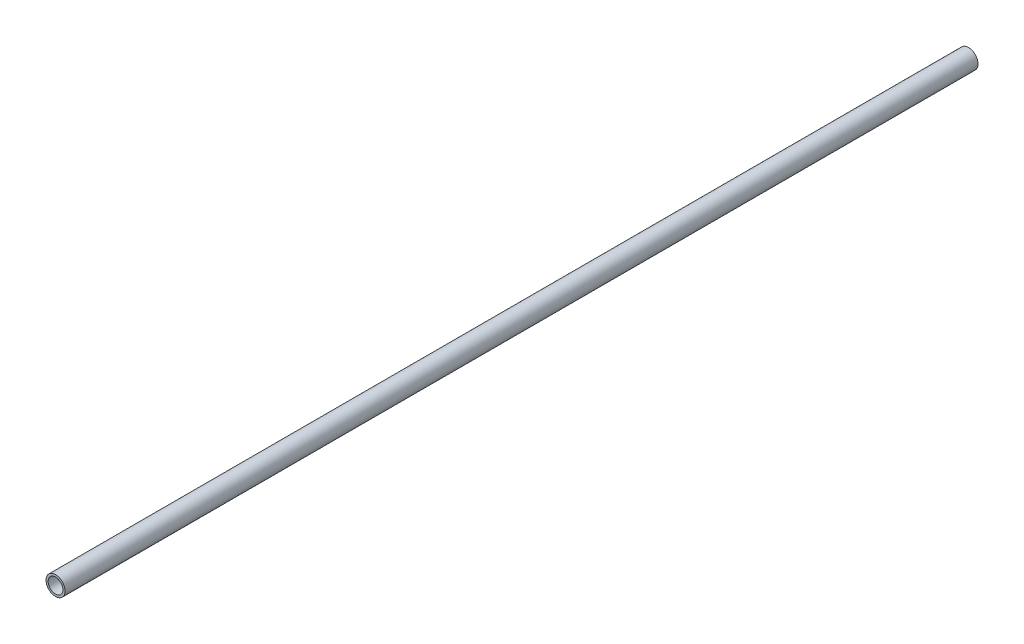
from build123d import *

# Parameters (mm, degrees)
SKETCH2_R           = 3.175
SKETCH2_R_2         = 2.4638
BOSS_EXTRUDE1_DEPTH = 152.4


with BuildPart() as part:
    # Sketch2 → Boss-Extrude1 (new, symmetric)
    with BuildSketch(Plane.XY):
        Circle(SKETCH2_R)
        Circle(SKETCH2_R_2, mode=Mode.SUBTRACT)
    extrude(amount=BOSS_EXTRUDE1_DEPTH, both=True)


solid = part.part
